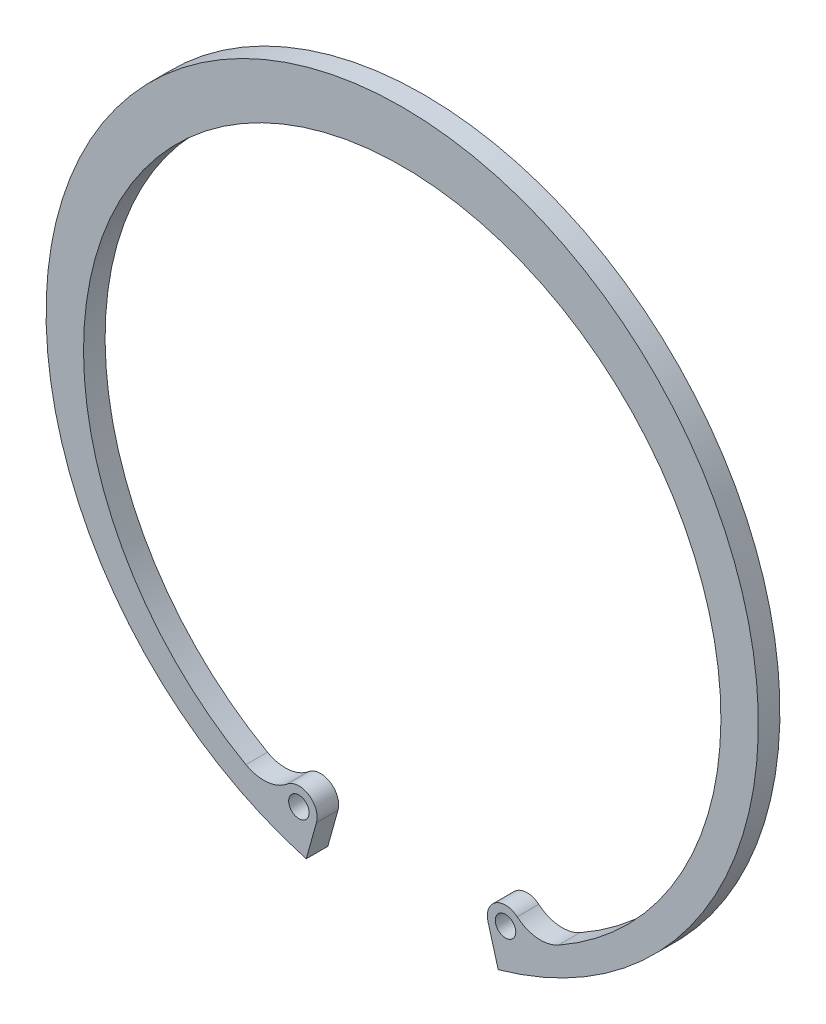
from build123d import *

# Parameters (mm, degrees)
SKETCH1_R           = 1.9
BOSS_EXTRUDE1_DEPTH = 4


with BuildPart() as part:
    # Sketch1 → Boss-Extrude1 (new body)
    with BuildSketch(Plane.XY):
        with BuildLine():
            Line((17.801991214, -63.605751381), (15.909561323, -56.844180516))
            ThreePointArc((15.909561323, -56.844180516), (17.331888256, -53.097314134), (21.331580773, -53.351245934))
            ThreePointArc((21.331580773, -53.351245934), (25.046699576, -54.90531314), (28.9855978, -54.067271739))
            ThreePointArc((28.9855978, -54.067271739), (0, 56.55), (-28.9855978, -54.067271739))
            ThreePointArc((-28.9855978, -54.067271739), (-25.046699576, -54.90531314), (-21.331580773, -53.351245934))
            ThreePointArc((-21.331580773, -53.351245934), (-17.331888256, -53.097314134), (-15.909561323, -56.844180516))
            Line((-15.909561323, -56.844180516), (-17.801991214, -63.605751381))
            ThreePointArc((-17.801991214, -63.605751381), (0, 66.05), (17.801991214, -63.605751381))
        make_face()
        with Locations((19.159665955, -55.934540541)):
            Circle(SKETCH1_R, mode=Mode.SUBTRACT)
        with Locations((-19.159665955, -55.934540541)):
            Circle(SKETCH1_R, mode=Mode.SUBTRACT)
    extrude(amount=BOSS_EXTRUDE1_DEPTH)


solid = part.part
